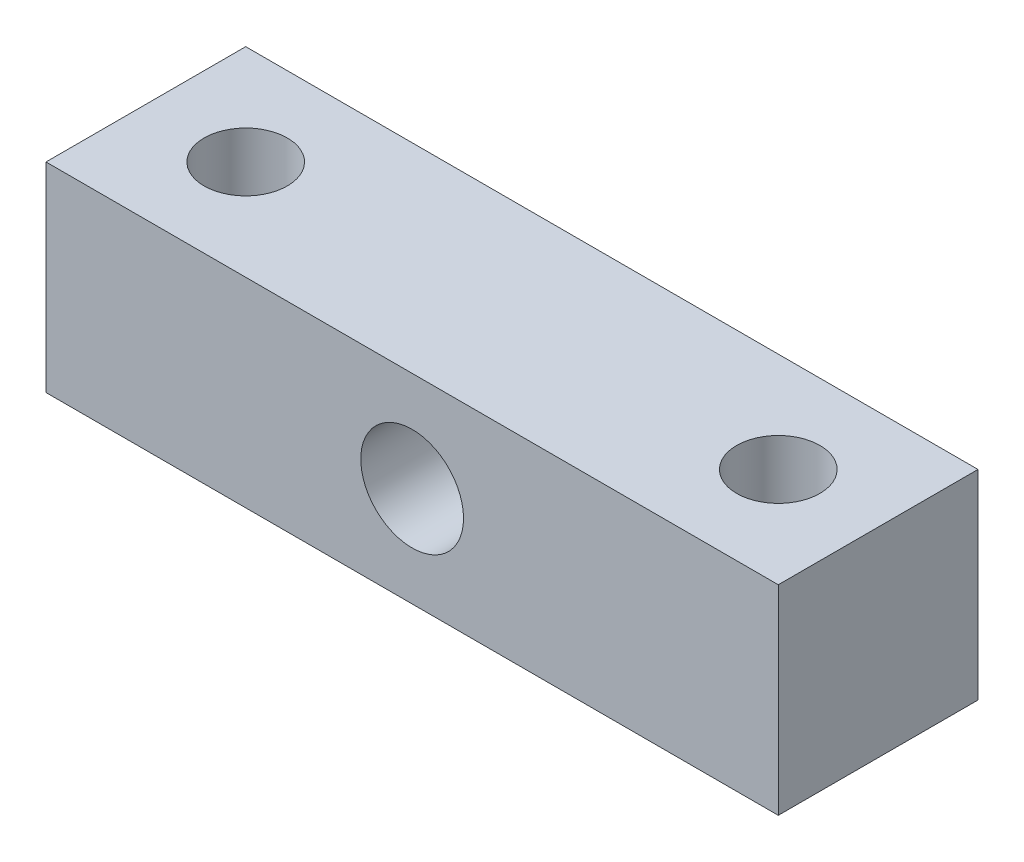
from build123d import *

# Parameters (mm, degrees)
SKETCH1_W                      = 69.85
SKETCH1_H                      = 19.05
BOSS_EXTRUDE1_DEPTH            = 19.05
F_3_8_CLEARANCE_HOLE1_D        = 9.8044
F_5_16_0_3125_DIAMETER_HOLE1_D = 7.9375


with BuildPart() as part:
    # Sketch1 → Boss-Extrude1 (new body)
    with BuildSketch(Plane.XY):
        Rectangle(SKETCH1_W, SKETCH1_H)
    extrude(amount=BOSS_EXTRUDE1_DEPTH)

    # 3/8 Clearance Hole1 (through all)
    with Locations(Plane.XY.offset(19.05)):
        with Locations((0, 0)):
            Hole(F_3_8_CLEARANCE_HOLE1_D / 2)

    # 5/16 (0.3125) Diameter Hole1 (through all)
    with Locations(Plane(origin=(0, 9.525, 0), x_dir=(1, 0, 0), z_dir=(0, 1, 0))):
        with Locations((-25.4, -9.525), (25.4, -9.525)):
            Hole(F_5_16_0_3125_DIAMETER_HOLE1_D / 2)


solid = part.part
